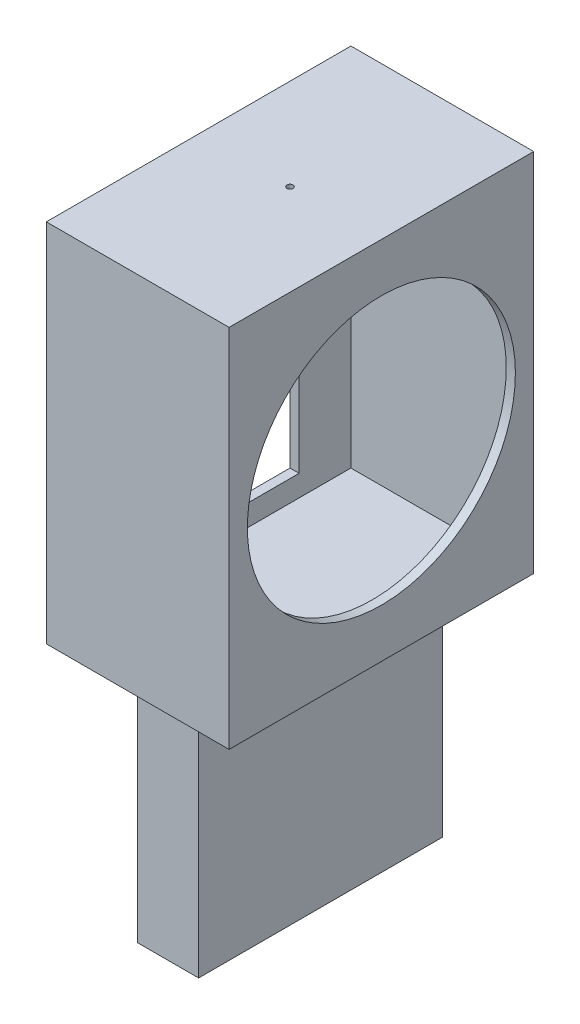
from build123d import *

# Parameters (mm, degrees)
OUTER_START        = 98
SKETCH1_W          = 100
SKETCH1_H          = 120
OUTER_DEPTH        = 60
INNER_START        = 101
SKETCH2_W          = 94
SKETCH2_H          = 114
INNER_DEPTH        = 54
THROAT_PORT_START  = 97
SKETCH3_W          = 60
SKETCH3_H          = 100
THROAT_PORT_DEPTH  = 5
FAN_PORT_START     = 154
SKETCH4_R          = 44
FAN_PORT_DEPTH     = 5
TC_PORT_START      = 196
SKETCH5_R          = 1
TC_PORT_DEPTH      = 5
PLENUM_STAND_START = 118
SKETCH6_W          = 80
SKETCH6_H          = 80
PLENUM_STAND_DEPTH = 20


with BuildPart() as part:
    # Sketch1 → outer (new body)
    with BuildSketch(Plane(origin=(0, 0, 0), x_dir=(0, 0, -1), z_dir=(1, 0, 0)).offset(OUTER_START)):
        with Locations((0, 140)):
            Rectangle(SKETCH1_W, SKETCH1_H)
    extrude(amount=OUTER_DEPTH)


with BuildPart() as body_2:
    # Sketch2 → inner (new body)
    with BuildSketch(Plane(origin=(0, 0, 0), x_dir=(0, 0, -1), z_dir=(1, 0, 0)).offset(INNER_START)):
        with Locations((0, 140)):
            Rectangle(SKETCH2_W, SKETCH2_H)
    extrude(amount=INNER_DEPTH)


with BuildPart() as body_3:
    # Sketch3 → throat_port (new body)
    with BuildSketch(Plane(origin=(0, 0, 0), x_dir=(0, 0, -1), z_dir=(1, 0, 0)).offset(THROAT_PORT_START)):
        with Locations((0, 140)):
            Rectangle(SKETCH3_W, SKETCH3_H)
    extrude(amount=THROAT_PORT_DEPTH)


with BuildPart() as body_4:
    # Sketch4 → fan_port (new body)
    with BuildSketch(Plane(origin=(0, 0, 0), x_dir=(0, 0, -1), z_dir=(1, 0, 0)).offset(FAN_PORT_START)):
        with Locations((0, 140)):
            Circle(SKETCH4_R)
    extrude(amount=FAN_PORT_DEPTH)


with BuildPart() as body_5:
    # Sketch5 → tc_port (new body)
    with BuildSketch(Plane(origin=(0, 0, 0), x_dir=(1, 0, 0), z_dir=(0, 1, 0)).offset(TC_PORT_START)):
        with Locations((128, 0)):
            Circle(SKETCH5_R)
    extrude(amount=TC_PORT_DEPTH)


with BuildPart() as part_1:
    add(part.part)

    # Combine1: cut body 2
    add(body_2.part, mode=Mode.SUBTRACT)

    # Combine2: cut body 3
    add(body_3.part, mode=Mode.SUBTRACT)

    # Combine3: cut body 4
    add(body_4.part, mode=Mode.SUBTRACT)

    # Combine4: cut body 5
    add(body_5.part, mode=Mode.SUBTRACT)


with BuildPart() as body_2_2:
    # Sketch6 → plenum_stand (new body)
    with BuildSketch(Plane(origin=(0, 0, 0), x_dir=(0, 0, -1), z_dir=(1, 0, 0)).offset(PLENUM_STAND_START)):
        with Locations((0, 40)):
            Rectangle(SKETCH6_W, SKETCH6_H)
    extrude(amount=PLENUM_STAND_DEPTH)


solid = Compound([part_1.part, body_2_2.part])
